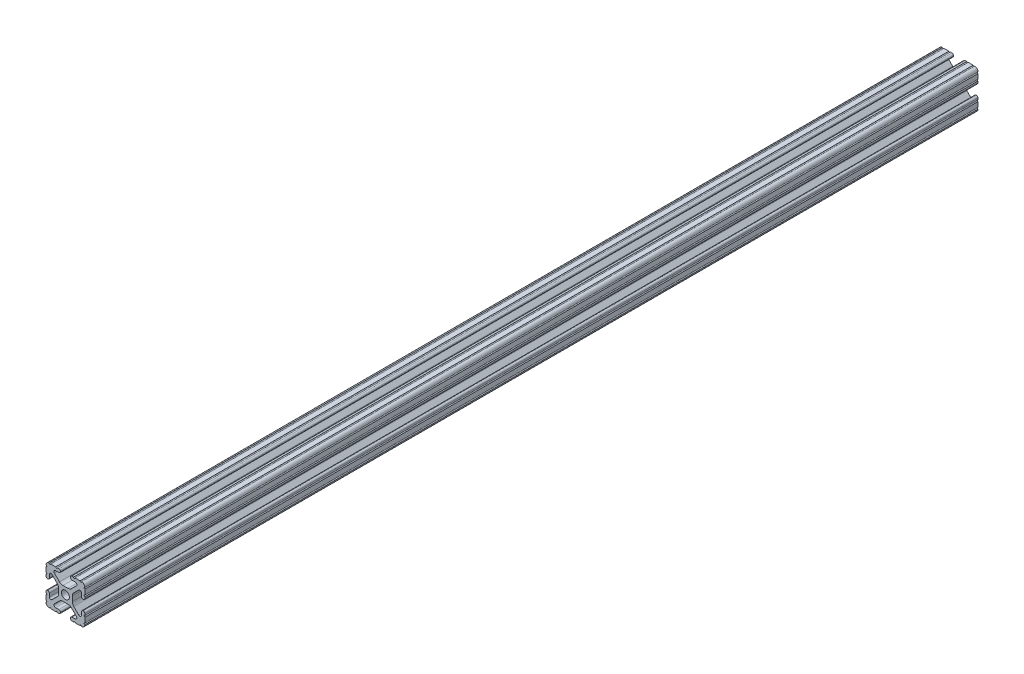
from build123d import *

# Parameters (mm, degrees)
SKETCH1_R           = 2.6035
BOSS_EXTRUDE1_DEPTH = 292.1


with BuildPart() as part:
    # Sketch1 → Boss-Extrude1 (new, symmetric)
    with BuildSketch(Plane.XY):
        with BuildLine():
            Line((-7.179650497, -8.645192506), (-3.952270251, -5.423690499))
            ThreePointArc((-3.952270251, -5.423690499), (-2.922936451, -4.736929036), (-1.709253557, -4.4958))
            Line((-1.709253557, -4.4958), (1.709253557, -4.4958))
            ThreePointArc((1.709253557, -4.4958), (2.922936451, -4.736929036), (3.952270251, -5.423690499))
            Line((3.952270251, -5.423690499), (7.179650497, -8.645192506))
            ThreePointArc((7.179650497, -8.645192506), (7.41473083, -9.822813117), (6.416408329, -10.4902))
            Line((6.416408329, -10.4902), (4.287512407, -10.4902))
            ThreePointArc((4.287512407, -10.4902), (3.54574862, -10.79744862), (3.2385, -11.539212407))
            Line((3.2385, -11.539212407), (3.2385, -11.650987593))
            ThreePointArc((3.2385, -11.650987593), (3.54574862, -12.39275138), (4.287512407, -12.7))
            Line((4.287512407, -12.7), (5.317126718, -12.7))
            ThreePointArc((5.317126718, -12.7), (5.825126718, -12.192), (6.333126718, -12.7))
            Line((6.333126718, -12.7), (9.550443118, -12.7))
            ThreePointArc((9.550443118, -12.7), (10.058366869, -12.192000006), (10.566443095, -12.699847501))
            ThreePointArc((10.566443095, -12.699847501), (12.082537762, -12.08250727), (12.699846982, -10.566399977))
            ThreePointArc((12.699846982, -10.566399977), (12.192000006, -10.058323491), (12.7, -9.5504))
            Line((12.7, -9.5504), (12.7, -6.3330836))
            ThreePointArc((12.7, -6.3330836), (12.192, -5.8250836), (12.7, -5.3170836))
            Line((12.7, -5.3170836), (12.7, -4.287469289))
            ThreePointArc((12.7, -4.287469289), (12.39275138, -3.545705502), (11.650987593, -3.238456882))
            Line((11.650987593, -3.238456882), (11.539212407, -3.238456882))
            ThreePointArc((11.539212407, -3.238456882), (10.79744862, -3.545705502), (10.4902, -4.287469289))
            Line((10.4902, -4.287469289), (10.4902, -6.402089023))
            ThreePointArc((10.4902, -6.402089023), (9.856505071, -7.351067942), (8.737131347, -7.129408934))
            Line((8.737131347, -7.129408934), (5.441005833, -3.840816462))
            ThreePointArc((5.441005833, -3.840816462), (4.750877967, -2.809883091), (4.5085, -1.593185507))
            Line((4.5085, -1.593185507), (4.5085, 1.593185507))
            ThreePointArc((4.5085, 1.593185507), (4.750877967, 2.809883091), (5.441005833, 3.840816462))
            Line((5.441005833, 3.840816462), (8.737131347, 7.129408934))
            ThreePointArc((8.737131347, 7.129408934), (9.856505071, 7.351067942), (10.4902, 6.402089023))
            Line((10.4902, 6.402089023), (10.4902, 4.287469289))
            ThreePointArc((10.4902, 4.287469289), (10.79744862, 3.545705502), (11.539212407, 3.238456882))
            Line((11.539212407, 3.238456882), (11.650987593, 3.238456882))
            ThreePointArc((11.650987593, 3.238456882), (12.39275138, 3.545705502), (12.7, 4.287469289))
            Line((12.7, 4.287469289), (12.7, 5.3170836))
            ThreePointArc((12.7, 5.3170836), (12.192, 5.8250836), (12.7, 6.3330836))
            Line((12.7, 6.3330836), (12.7, 9.5504))
            ThreePointArc((12.7, 9.5504), (12.192000006, 10.058323491), (12.699846982, 10.566399977))
            ThreePointArc((12.699846982, 10.566399977), (12.082537762, 12.08250727), (10.566443095, 12.699847501))
            ThreePointArc((10.566443095, 12.699847501), (10.058366869, 12.192000006), (9.550443118, 12.7))
            Line((9.550443118, 12.7), (6.333126718, 12.7))
            ThreePointArc((6.333126718, 12.7), (5.825126718, 12.192), (5.317126718, 12.7))
            Line((5.317126718, 12.7), (4.287512407, 12.7))
            ThreePointArc((4.287512407, 12.7), (3.54574862, 12.39275138), (3.2385, 11.650987593))
            Line((3.2385, 11.650987593), (3.2385, 11.539212407))
            ThreePointArc((3.2385, 11.539212407), (3.54574862, 10.79744862), (4.287512407, 10.4902))
            Line((4.287512407, 10.4902), (6.476788598, 10.4902))
            ThreePointArc((6.476788598, 10.4902), (7.432222385, 9.85140422), (7.207036008, 8.724370562))
            Line((7.207036008, 8.724370562), (3.898272566, 5.423169045))
            ThreePointArc((3.898272566, 5.423169045), (2.869120213, 4.736787962), (1.655778399, 4.4958))
            Line((1.655778399, 4.4958), (-1.655778399, 4.4958))
            ThreePointArc((-1.655778399, 4.4958), (-2.869120213, 4.736787962), (-3.898272566, 5.423169045))
            Line((-3.898272566, 5.423169045), (-7.207036008, 8.724370562))
            ThreePointArc((-7.207036008, 8.724370562), (-7.432222385, 9.85140422), (-6.476788598, 10.4902))
            Line((-6.476788598, 10.4902), (-4.287512407, 10.4902))
            ThreePointArc((-4.287512407, 10.4902), (-3.54574862, 10.79744862), (-3.2385, 11.539212407))
            Line((-3.2385, 11.539212407), (-3.2385, 11.650987593))
            ThreePointArc((-3.2385, 11.650987593), (-3.54574862, 12.39275138), (-4.287512407, 12.7))
            Line((-4.287512407, 12.7), (-5.317126718, 12.7))
            ThreePointArc((-5.317126718, 12.7), (-5.825126718, 12.192), (-6.333126718, 12.7))
            Line((-6.333126718, 12.7), (-9.550443118, 12.7))
            ThreePointArc((-9.550443118, 12.7), (-10.058366869, 12.192000006), (-10.566443095, 12.699847501))
            ThreePointArc((-10.566443095, 12.699847501), (-12.082537762, 12.08250727), (-12.699846982, 10.566399977))
            ThreePointArc((-12.699846982, 10.566399977), (-12.192000006, 10.058323491), (-12.7, 9.5504))
            Line((-12.7, 9.5504), (-12.7, 6.3330836))
            ThreePointArc((-12.7, 6.3330836), (-12.192, 5.8250836), (-12.7, 5.3170836))
            Line((-12.7, 5.3170836), (-12.7, 4.287469289))
            ThreePointArc((-12.7, 4.287469289), (-12.39275138, 3.545705502), (-11.650987593, 3.238456882))
            Line((-11.650987593, 3.238456882), (-11.539212407, 3.238456882))
            ThreePointArc((-11.539212407, 3.238456882), (-10.79744862, 3.545705502), (-10.4902, 4.287469289))
            Line((-10.4902, 4.287469289), (-10.4902, 6.402089023))
            ThreePointArc((-10.4902, 6.402089023), (-9.856505071, 7.351067942), (-8.737131347, 7.129408934))
            Line((-8.737131347, 7.129408934), (-5.441005833, 3.840816462))
            ThreePointArc((-5.441005833, 3.840816462), (-4.750877967, 2.809883091), (-4.5085, 1.593185507))
            Line((-4.5085, 1.593185507), (-4.5085, -1.593185507))
            ThreePointArc((-4.5085, -1.593185507), (-4.750877967, -2.809883091), (-5.441005833, -3.840816462))
            Line((-5.441005833, -3.840816462), (-8.737131347, -7.129408934))
            ThreePointArc((-8.737131347, -7.129408934), (-9.856505071, -7.351067942), (-10.4902, -6.402089023))
            Line((-10.4902, -6.402089023), (-10.4902, -4.287469289))
            ThreePointArc((-10.4902, -4.287469289), (-10.79744862, -3.545705502), (-11.539212407, -3.238456882))
            Line((-11.539212407, -3.238456882), (-11.650987593, -3.238456882))
            ThreePointArc((-11.650987593, -3.238456882), (-12.39275138, -3.545705502), (-12.7, -4.287469289))
            Line((-12.7, -4.287469289), (-12.7, -5.3170836))
            ThreePointArc((-12.7, -5.3170836), (-12.192, -5.8250836), (-12.7, -6.3330836))
            Line((-12.7, -6.3330836), (-12.7, -9.5504))
            ThreePointArc((-12.7, -9.5504), (-12.192000006, -10.058323491), (-12.699846982, -10.566399977))
            ThreePointArc((-12.699846982, -10.566399977), (-12.082537762, -12.08250727), (-10.566443095, -12.699847501))
            ThreePointArc((-10.566443095, -12.699847501), (-10.058366869, -12.192000006), (-9.550443118, -12.7))
            Line((-9.550443118, -12.7), (-6.333126718, -12.7))
            ThreePointArc((-6.333126718, -12.7), (-5.825126718, -12.192), (-5.317126718, -12.7))
            Line((-5.317126718, -12.7), (-4.287512407, -12.7))
            ThreePointArc((-4.287512407, -12.7), (-3.54574862, -12.39275138), (-3.2385, -11.650987593))
            Line((-3.2385, -11.650987593), (-3.2385, -11.539212407))
            ThreePointArc((-3.2385, -11.539212407), (-3.54574862, -10.79744862), (-4.287512407, -10.4902))
            Line((-4.287512407, -10.4902), (-6.416408329, -10.4902))
            ThreePointArc((-6.416408329, -10.4902), (-7.41473083, -9.822813117), (-7.179650497, -8.645192506))
        make_face()
        Circle(SKETCH1_R, mode=Mode.SUBTRACT)
    extrude(amount=BOSS_EXTRUDE1_DEPTH, both=True)


solid = part.part
